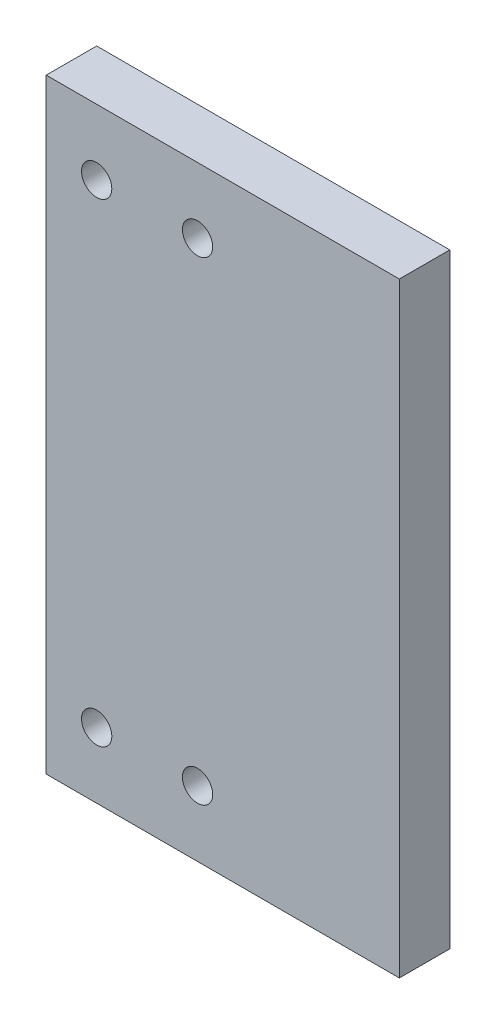
from build123d import *

# Parameters (mm, degrees)
ESQUISSE1_R        = 1.5
BOSS_EXTRU_1_DEPTH = 5


with BuildPart() as part:
    # Esquisse1 → Boss.-Extru.1 (new body)
    with BuildSketch(Plane.XY):
        Polygon((0, 0), (35, 0), (35, 60), (0, 60), (0, 50), (0, 10), align=None)
        with Locations((5, 53.5)):
            Circle(ESQUISSE1_R, mode=Mode.SUBTRACT)
        with Locations(Location((15, 53.5, 0), (0, 0, 180))):
            Circle(ESQUISSE1_R, mode=Mode.SUBTRACT)
        with Locations((15, 6.5)):
            Circle(ESQUISSE1_R, mode=Mode.SUBTRACT)
        with Locations(Location((5, 6.5, 0), (0, 0, 180))):
            Circle(ESQUISSE1_R, mode=Mode.SUBTRACT)
    extrude(amount=BOSS_EXTRU_1_DEPTH)


solid = part.part
